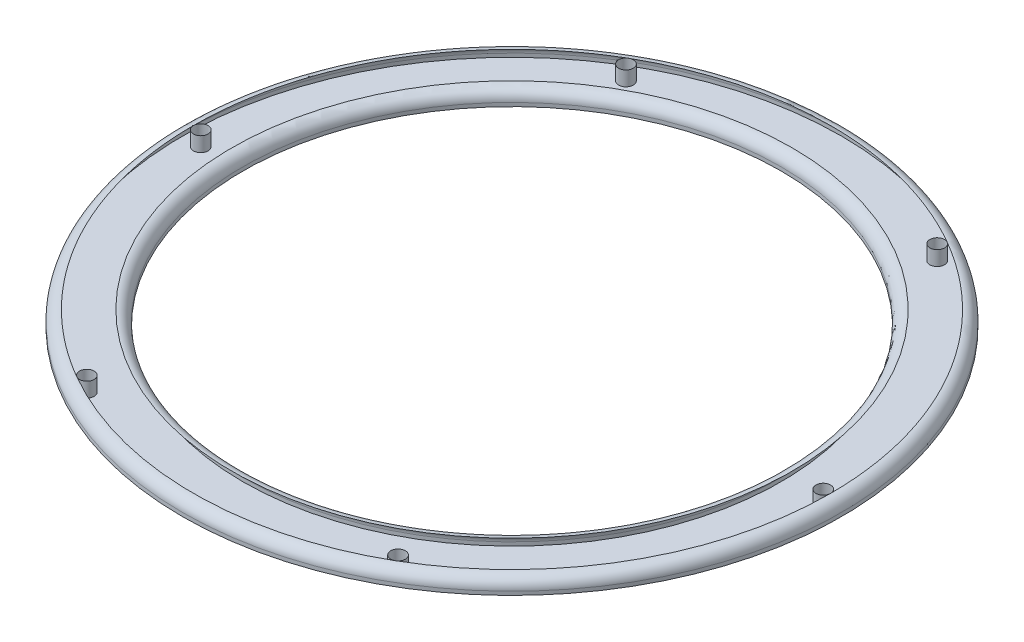
from build123d import *

# Parameters (mm, degrees)
SKETCH2_R          = 2
CUT_EXTRUDE1_DEPTH = 128.342059109
CIRPATTERN1_COUNT  = 6


with BuildPart() as part:
    # Sketch1 → Revolve1 (revolve)
    with BuildSketch(Plane.XY, mode=Mode.PRIVATE) as revolve1_sk:
        with BuildLine():
            Line((-73.5, 0), (-90, 0))
            Line((-90, 0), (-90, 1))
            ThreePointArc((-90, 1), (-89.121320344, 3.121320344), (-87, 4))
            Line((-87, 4), (-76.5, 4))
            ThreePointArc((-76.5, 4), (-74.378679656, 3.121320344), (-73.5, 1))
            Line((-73.5, 1), (-73.5, 0))
        make_face()
    revolve(revolve1_sk.sketch.rotate(Axis((0, 0, 0), (0, 1, 0)), 270), axis=Axis((0, 0, 0), (0, 1, 0)))

    # Sketch2 → Cut-Extrude1 (cut, through all)
    with BuildSketch(Plane(origin=(0, 4, 0), x_dir=(1, 0, 0), z_dir=(0, 1, 0))):
        with Locations(Location((-85, 0, 0), (0, 0, 270))):
            Circle(SKETCH2_R)
    cut_extrude1 = extrude(amount=-CUT_EXTRUDE1_DEPTH, mode=Mode.SUBTRACT)

    # CirPattern1: Cut-Extrude1 ×6 about axis
    cirpattern1_axis = Axis((0, 0, 0), (0, 1, 0))
    for i in range(1, CIRPATTERN1_COUNT):
        add(cut_extrude1.rotate(cirpattern1_axis, i * 360 / CIRPATTERN1_COUNT), mode=Mode.SUBTRACT)


solid = part.part
